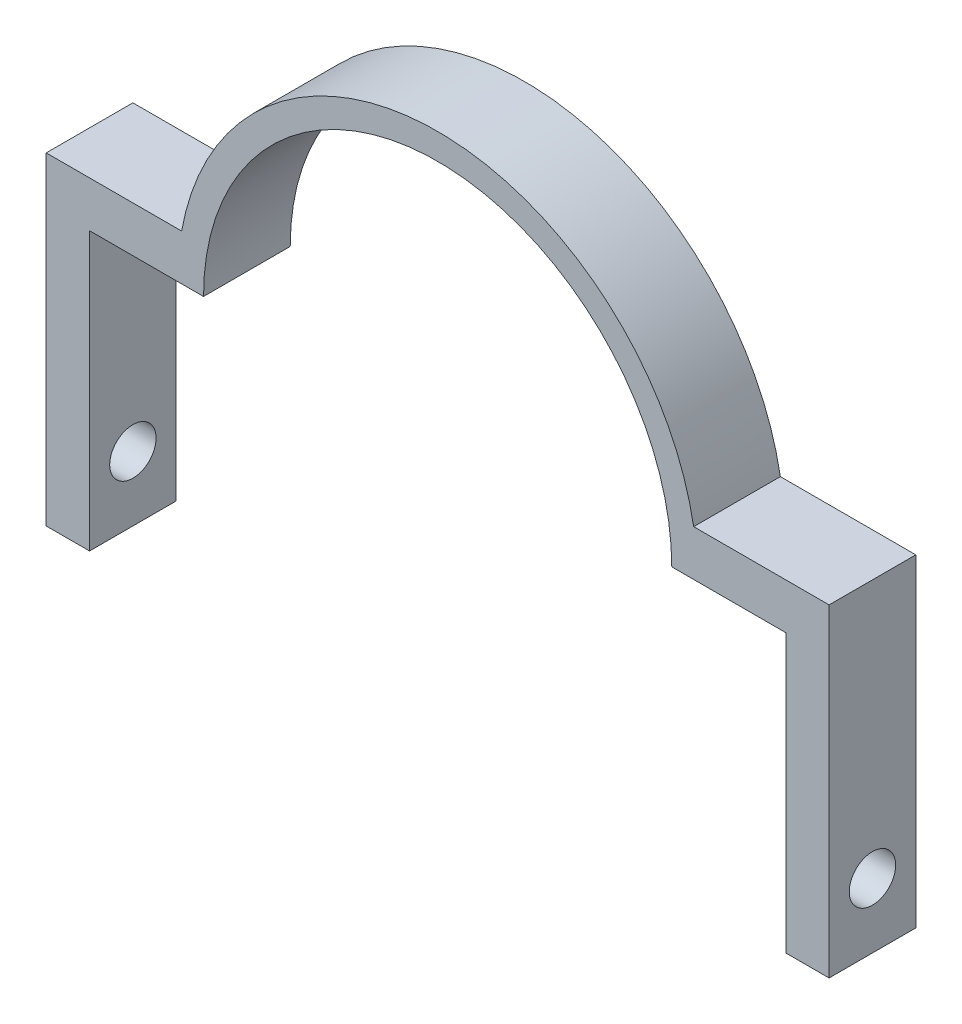
from build123d import *

# Parameters (mm, degrees)
BOSS_EXTRUDE1_DEPTH = 6.35
SKETCH2_R           = 1.700000029
CUT_EXTRUDE1_DEPTH  = 62.171998628


with BuildPart() as part:
    # Sketch1 → Boss-Extrude1 (new body)
    with BuildSketch(Plane.XY):
        with BuildLine():
            Line((-17.15, 0), (-25.49898, 0))
            Line((-25.49898, 0), (-25.49898, -20.32))
            Line((-25.49898, -20.32), (-28.67398, -20.32))
            Line((-28.67398, -20.32), (-28.67398, 3.350143749))
            Line((-28.67398, 3.350143749), (-18.753107392, 3.350143749))
            ThreePointArc((-18.753107392, 3.350143749), (0, 19.05), (18.753107392, 3.350143749))
            Line((18.753107392, 3.350143749), (28.67398, 3.350143749))
            Line((28.67398, 3.350143749), (28.67398, -20.32))
            Line((28.67398, -20.32), (25.49898, -20.32))
            Line((25.49898, -20.32), (25.49898, 0))
            Line((25.49898, 0), (17.15, 0))
            ThreePointArc((17.15, 0), (0, 17.15), (-17.15, 0))
        make_face()
    extrude(amount=BOSS_EXTRUDE1_DEPTH)

    # Sketch2 → Cut-Extrude1 (cut, through all)
    with BuildSketch(Plane(origin=(28.67398, 0, 0), x_dir=(0, 0, -1), z_dir=(1, 0, 0))):
        with Locations(Location((-3.175, -15.587842251, 0), (0, 0, 90))):
            Circle(SKETCH2_R)
    extrude(amount=-CUT_EXTRUDE1_DEPTH, mode=Mode.SUBTRACT)


solid = part.part
